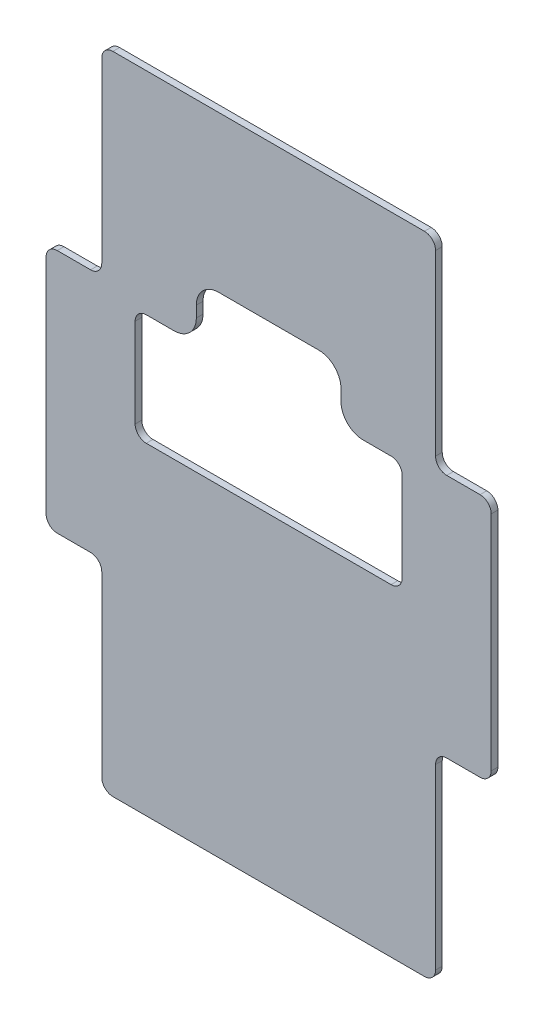
from build123d import *

# Parameters (mm, degrees)
BOSS_EXTRUDE1_DEPTH = 3
FILLET1_R           = 5
CUT_EXTRUDE8_DEPTH  = 177.164695669


with BuildPart() as part:
    # Sketch1 → Boss-Extrude1 (new body)
    with BuildSketch(Plane.XY):
        Polygon((-75, -145), (75, -145), (75, -55), (100, -55), (100, 55), (75, 55), (75, 145), (-75, 145), (-75, 55), (-100, 55), (-100, -55), (-75, -55), align=None)
    extrude(amount=BOSS_EXTRUDE1_DEPTH)

    # Fillet1
    fillet1_edges = [part.edges().sort_by_distance(p)[0] for p in [
        (-75, -55, 1.5),
        (-100, -55, 1.5),
        (-100, 55, 1.5),
        (-75, 55, 1.5),
        (-75, 145, 1.5),
        (75, 145, 1.5),
        (75, 55, 1.5),
        (100, 55, 1.5),
        (100, -55, 1.5),
        (75, -55, 1.5),
        (75, -145, 1.5),
        (-75, -145, 1.5),
    ]]
    fillet(fillet1_edges, radius=FILLET1_R)

    # Sketch13 → Cut-Extrude8 (cut, through all)
    with BuildSketch(Plane(origin=(0, 0, 0), x_dir=(-1, 0, 0), z_dir=(0, 0, -1))):
        with BuildLine():
            Line((-55, 50), (-42.5, 50))
            ThreePointArc((-42.5, 50), (-35.428932188, 52.928932188), (-32.5, 60))
            Line((-32.5, 60), (-32.5, 65))
            ThreePointArc((-32.5, 65), (-29.571067812, 72.071067812), (-22.5, 75))
            Line((-22.5, 75), (22.5, 75))
            ThreePointArc((22.5, 75), (29.571067812, 72.071067812), (32.5, 65))
            Line((32.5, 65), (32.5, 60))
            ThreePointArc((32.5, 60), (35.428932188, 52.928932188), (42.5, 50))
            Line((42.5, 50), (55, 50))
            ThreePointArc((55, 50), (58.535533906, 48.535533906), (60, 45))
            Line((60, 45), (60, 5))
            ThreePointArc((60, 5), (58.535533906, 1.464466094), (55, 0))
            Line((55, 0), (-55, 0))
            ThreePointArc((-55, 0), (-58.535533906, 1.464466094), (-60, 5))
            Line((-60, 5), (-60, 45))
            ThreePointArc((-60, 45), (-58.535533906, 48.535533906), (-55, 50))
        make_face()
    extrude(amount=-CUT_EXTRUDE8_DEPTH, mode=Mode.SUBTRACT)


solid = part.part
